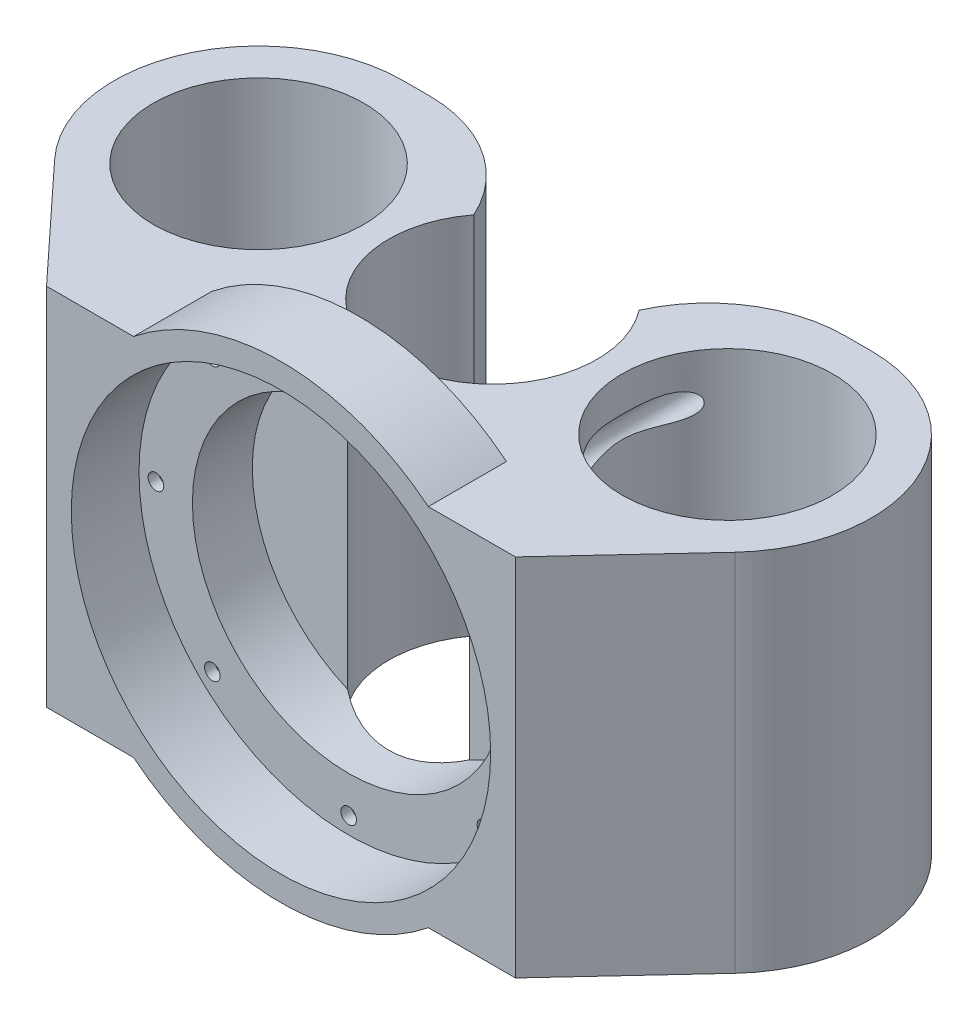
from build123d import *

# Parameters (mm, degrees)
EXTRUDE_1_DEPTH      = 35
EXTRUDE_1_DEPTH_BACK = 35
SKETCH_1_R           = 20.2
SKETCH_1_R_2         = 20
SKETCH_9_R           = 45
EXTRUDE_2_DEPTH      = 15
SKETCH_6_R           = 40.25
CUT_EXTRUDE_5_DEPTH  = 13
SKETCH_7_R           = 30
CUT_EXTRUDE_6_DEPTH  = 11.5
CUT_EXTRUDE_7_DEPTH  = 116.506623187
SKETCH_12_R          = 1.5
CUT_EXTRUDE_10_DEPTH = 10
SKETCH_13_R          = 2.5
CUT_EXTRUDE_11_DEPTH = 101.806001805


with BuildPart() as part:
    # 草图1 → 凸台-拉伸1 (new, two sides: drawn at the far end of the back side and taken through both)
    with BuildSketch(Plane(origin=(0, 0, 0), x_dir=(1, 0, 0), z_dir=(0, 1, 0)).offset(-EXTRUDE_1_DEPTH_BACK)):
        with BuildLine():
            Line((-45, 27.7), (0, 27.7))
            Line((0, 27.7), (45, 27.7))
            ThreePointArc((45, 27.7), (70.391924464, 11.069786447), (65.294814535, -18.852334152))
            Line((65.294814535, -18.852334152), (45, -40.7))
            Line((45, -40.7), (-45, -40.7))
            Line((-45, -40.7), (-65.294814535, -18.852334152))
            ThreePointArc((-65.294814535, -18.852334152), (-70.391924464, 11.069786447), (-45, 27.7))
        make_face()
        with Locations((-45, 0)):
            Circle(SKETCH_1_R, mode=Mode.SUBTRACT)
        with Locations((45, 0)):
            Circle(SKETCH_1_R, mode=Mode.SUBTRACT)
        Circle(SKETCH_1_R_2, mode=Mode.SUBTRACT)
    extrude(amount=EXTRUDE_1_DEPTH + EXTRUDE_1_DEPTH_BACK)

    # 草图9 → 凸台-拉伸2 (add)
    with BuildSketch(Plane.XY.offset(40.7)):
        Circle(SKETCH_9_R)
    extrude(amount=-EXTRUDE_2_DEPTH)

    # 草图6 → 切除-拉伸5 (cut)
    with BuildSketch(Plane.XY.offset(40.7)):
        Circle(SKETCH_6_R)
    extrude(amount=-CUT_EXTRUDE_5_DEPTH, mode=Mode.SUBTRACT)

    # 草图7 → 切除-拉伸6 (cut)
    with BuildSketch(Plane.XY.offset(27.7)):
        Circle(SKETCH_7_R)
    extrude(amount=-CUT_EXTRUDE_6_DEPTH, mode=Mode.SUBTRACT)

    # 草图8 → 切除-拉伸7 (cut, through all)
    with BuildSketch(Plane.XZ.offset(35)):
        with BuildLine():
            Line((39.905119777, -27.7), (-39.905119777, -27.7))
            ThreePointArc((-39.905119777, -27.7), (-24.856634471, -22.987295364), (-15.184355771, -10.532837537))
            ThreePointArc((-15.184355771, -10.532837537), (0, 0.011832617), (15.184355771, -10.532837537))
            ThreePointArc((15.184355771, -10.532837537), (24.856634471, -22.987295364), (39.905119777, -27.7))
        make_face()
    extrude(amount=-CUT_EXTRUDE_7_DEPTH, mode=Mode.SUBTRACT)

    # 草图12 → 切除-拉伸10 (cut)
    with BuildSketch(Plane.XY.offset(27.7)):
        with Locations((0, 37)):
            Circle(SKETCH_12_R)
        with Locations((0, -37)):
            Circle(SKETCH_12_R)
        with Locations((-37, 0)):
            Circle(SKETCH_12_R)
        with Locations((37, 0)):
            Circle(SKETCH_12_R)
        with Locations((26.162950904, 26.162950904)):
            Circle(SKETCH_12_R)
        with Locations((-26.162950904, 26.162950904)):
            Circle(SKETCH_12_R)
        with Locations((-26.162950904, -26.162950904)):
            Circle(SKETCH_12_R)
        with Locations((26.162950904, -26.162950904)):
            Circle(SKETCH_12_R)
    extrude(amount=-CUT_EXTRUDE_10_DEPTH, mode=Mode.SUBTRACT)

    # 草图13 → 切除-拉伸11 (cut, through all)
    with BuildSketch(Plane.XY.offset(25.7)):
        with Locations((0, 37)):
            Circle(SKETCH_13_R)
        with Locations((26.162950904, 26.162950904)):
            Circle(SKETCH_13_R)
        with Locations((37, 0)):
            Circle(SKETCH_13_R)
        with Locations((26.162950904, -26.162950904)):
            Circle(SKETCH_13_R)
        with Locations((0, -37)):
            Circle(SKETCH_13_R)
        with Locations((-26.162950904, -26.162950904)):
            Circle(SKETCH_13_R)
        with Locations((-37, 0)):
            Circle(SKETCH_13_R)
        with Locations((-26.162950904, 26.162950904)):
            Circle(SKETCH_13_R)
    extrude(amount=-CUT_EXTRUDE_11_DEPTH, mode=Mode.SUBTRACT)


solid = part.part
